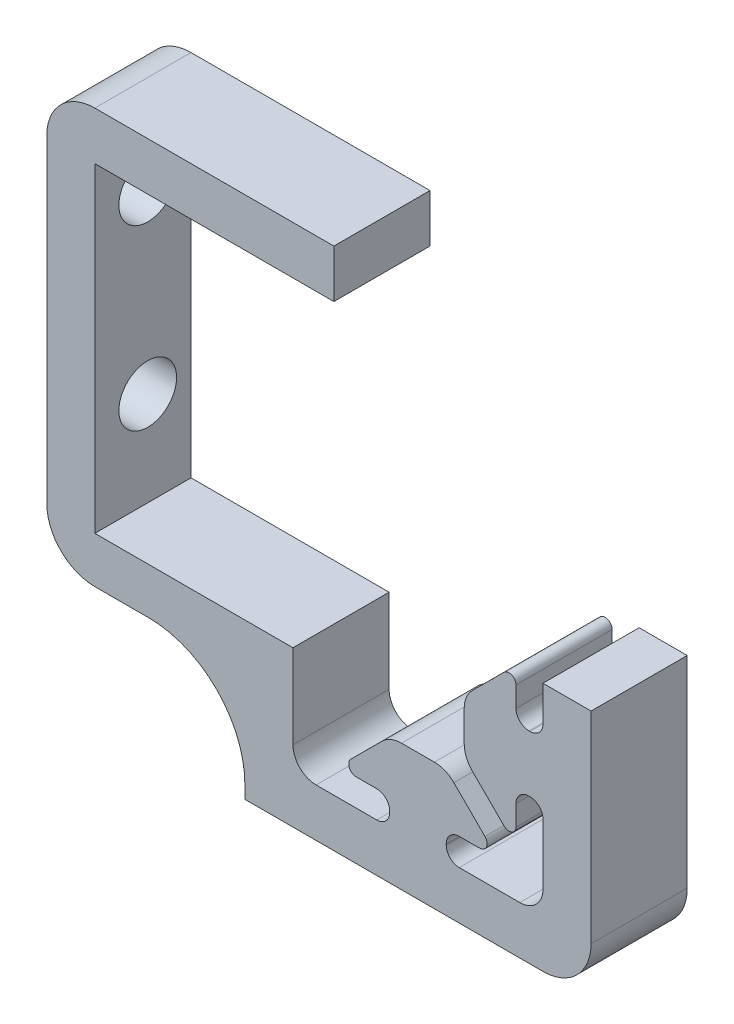
from build123d import *

# Parameters (mm, degrees)
BOSS_EXTRUDE1_DEPTH = 10
CUT_EXTRUDE1_REACH  = 70.061
SKETCH2_R           = 3
FILLET1_R           = 10
FILLET2_R           = 5


with BuildPart() as part:
    # Sketch1 → Boss-Extrude1 (new body)
    with BuildSketch(Plane.XY):
        with BuildLine():
            Line((-10.5918, -13), (-4.305880552, -13))
            Line((-4.305880552, -13), (-4.287512407, -13))
            ThreePointArc((-4.287512407, -13), (-3.333616586, -12.604883414), (-2.9385, -11.650987593))
            Line((-2.9385, -11.650987593), (-2.9385, -11.539212407))
            ThreePointArc((-2.9385, -11.539212407), (-3.333616586, -10.585316586), (-4.287512407, -10.1902))
            Line((-4.287512407, -10.1902), (-6.416408329, -10.1902))
            ThreePointArc((-6.416408329, -10.1902), (-7.137514675, -9.708134418), (-6.967711912, -8.857517813))
            Line((-6.967711912, -8.857517813), (-3.740331666, -5.636015806))
            ThreePointArc((-3.740331666, -5.636015806), (-2.808257752, -5.01414519), (-1.709253557, -4.7958))
            Line((-1.709253557, -4.7958), (1.709253557, -4.7958))
            ThreePointArc((1.709253557, -4.7958), (2.808257752, -5.01414519), (3.740331666, -5.636015806))
            Line((3.740331666, -5.636015806), (6.967711912, -8.857517813))
            ThreePointArc((6.967711912, -8.857517813), (7.137514675, -9.708134418), (6.416408329, -10.1902))
            Line((6.416408329, -10.1902), (4.287512407, -10.1902))
            ThreePointArc((4.287512407, -10.1902), (3.333616586, -10.585316586), (2.9385, -11.539212407))
            Line((2.9385, -11.539212407), (2.9385, -11.650987593))
            ThreePointArc((2.9385, -11.650987593), (3.333616586, -12.604883414), (4.287512407, -13))
            Line((4.287512407, -13), (5.321597603, -13))
            Line((5.321597603, -13), (10.5918, -13))
            ThreePointArc((10.5918, -13), (12.29465455, -12.29465455), (13, -10.5918))
            Line((13, -10.5918), (13, -5.3170836))
            Line((13, -5.3170836), (13, -4.287469289))
            ThreePointArc((13, -4.287469289), (12.604883414, -3.333573468), (11.650987593, -2.938456882))
            Line((11.650987593, -2.938456882), (11.539212407, -2.938456882))
            ThreePointArc((11.539212407, -2.938456882), (10.585316586, -3.333573468), (10.1902, -4.287469289))
            Line((10.1902, -4.287469289), (10.1902, -6.402089023))
            ThreePointArc((10.1902, -6.402089023), (9.74154152, -7.073969797), (8.94902056, -6.917034355))
            Line((8.94902056, -6.917034355), (5.652895046, -3.628441884))
            ThreePointArc((5.652895046, -3.628441884), (5.027976112, -2.694919539), (4.8085, -1.593185507))
            Line((4.8085, -1.593185507), (4.8085, 1.593185507))
            ThreePointArc((4.8085, 1.593185507), (5.027976112, 2.694919539), (5.652895046, 3.628441884))
            Line((5.652895046, 3.628441884), (8.94902056, 6.917034355))
            ThreePointArc((8.94902056, 6.917034355), (9.74154152, 7.073969797), (10.1902, 6.402089023))
            Line((10.1902, 6.402089023), (10.1902, 4.287469289))
            ThreePointArc((10.1902, 4.287469289), (10.585316586, 3.333573468), (11.539212407, 2.938456882))
            Line((11.539212407, 2.938456882), (11.650987593, 2.938456882))
            ThreePointArc((11.650987593, 2.938456882), (12.604883414, 3.333573468), (13, 4.287469289))
            Line((13, 4.287469289), (13, 5.3170836))
            Line((13, 5.3170836), (13, 7.9544418))
            Line((13, 7.9544418), (18, 7.9544418))
            Line((18, 7.9544418), (18, -18))
            Line((18, -18), (-18, -18))
            Line((-18, -18), (-18, -6.6473334))
            Line((-18, -6.6473334), (-38.6, -6.6473334))
            Line((-38.6, -6.6473334), (-38.6, 36.4526666))
            Line((-38.6, 36.4526666), (-8.745302284, 36.4526666))
            Line((-8.745302284, 36.4526666), (-8.745302284, 31.4526666))
            Line((-8.745302284, 31.4526666), (-33.6, 31.4526666))
            Line((-33.6, 31.4526666), (-33.6, -1.8473334))
            Line((-33.6, -1.8473334), (-13, -1.8473334))
            Line((-13, -1.8473334), (-13, -4.287469289))
            Line((-13, -4.287469289), (-13, -10.5918))
            ThreePointArc((-13, -10.5918), (-12.29465455, -12.29465455), (-10.5918, -13))
        make_face()
    extrude(amount=BOSS_EXTRUDE1_DEPTH)

    # Sketch2 → Cut-Extrude1 (cut, up to next)
    with BuildSketch(Plane.ZY.offset(38.6), mode=Mode.PRIVATE) as cut_extrude1_sk1:
        with Locations((4.5, 26.4526666)):
            Circle(SKETCH2_R)
    cut_extrude1_tool1 = extrude(cut_extrude1_sk1.sketch, amount=-CUT_EXTRUDE1_REACH, mode=Mode.PRIVATE) & part.part
    # Sketch2 → Cut-Extrude1 (cut, up to next)
    with BuildSketch(Plane.ZY.offset(38.6), mode=Mode.PRIVATE) as cut_extrude1_sk2:
        with Locations((4.5, 7.9526666)):
            Circle(SKETCH2_R)
    cut_extrude1_tool2 = extrude(cut_extrude1_sk2.sketch, amount=-CUT_EXTRUDE1_REACH, mode=Mode.PRIVATE) & part.part
    add(cut_extrude1_tool1.solids().sort_by_distance((-38.6, 26.452667, 4.5))[0], mode=Mode.SUBTRACT)
    add(cut_extrude1_tool2.solids().sort_by_distance((-38.6, 7.952667, 4.5))[0], mode=Mode.SUBTRACT)

    # Fillet1
    fillet1_edges = [part.edges().sort_by_distance(p)[0] for p in [
        (-18, -6.6473334, 5),
    ]]
    fillet(fillet1_edges, radius=FILLET1_R)

    # Fillet2
    fillet2_edges = [part.edges().sort_by_distance(p)[0] for p in [
        (18, -18, 5),
        (-38.6, -6.6473334, 5),
        (-38.6, 36.4526666, 5),
    ]]
    fillet(fillet2_edges, radius=FILLET2_R)


solid = part.part
